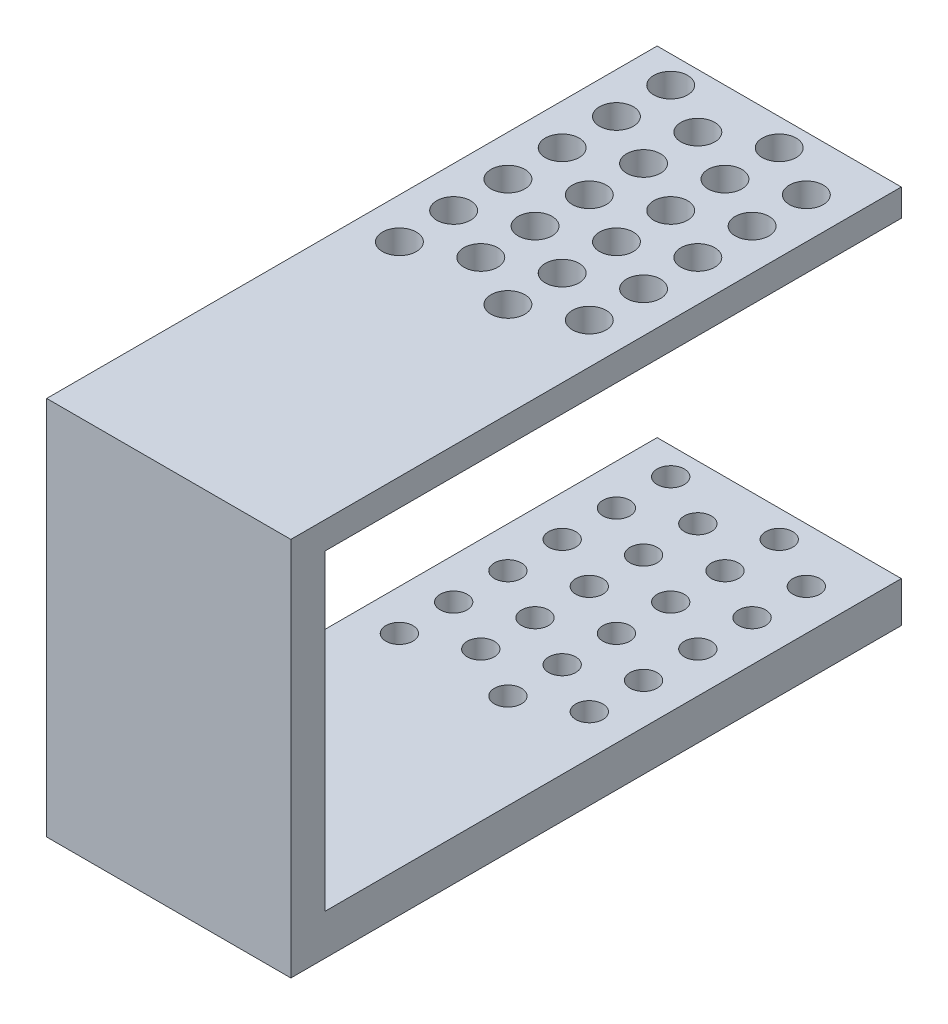
from build123d import *

# Parameters (mm, degrees)
SKETCH2_W           = 18
SKETCH2_H           = 24
SKETCH2_R           = 1.25
BOSS_EXTRUDE2_DEPTH = 2
SKETCH3_W           = 18
SKETCH3_H           = 2
BOSS_EXTRUDE3_DEPTH = 21
SKETCH4_W           = 18
SKETCH4_H           = 2.5
BOSS_EXTRUDE4_DEPTH = 26
SKETCH5_W           = 18
SKETCH5_H           = 3
BOSS_EXTRUDE5_DEPTH = 42.5
SKETCH15_R          = 1
CUT_EXTRUDE3_DEPTH  = 2


with BuildPart() as part:
    # Sketch2 → Boss-Extrude2 (new body)
    with BuildSketch(Plane(origin=(0, 0, 0), x_dir=(1, 0, 0), z_dir=(0, 1, 0))):
        with Locations((-11, 4)):
            Rectangle(SKETCH2_W, SKETCH2_H)
        with Locations(Location((-17, -6, 0), (0, 0, 270))):
            Circle(SKETCH2_R, mode=Mode.SUBTRACT)
        with Locations(Location((-17, -2, 0), (0, 0, 270))):
            Circle(SKETCH2_R, mode=Mode.SUBTRACT)
        with Locations(Location((-17, 2, 0), (0, 0, 270))):
            Circle(SKETCH2_R, mode=Mode.SUBTRACT)
        with Locations(Location((-17, 6, 0), (0, 0, 270))):
            Circle(SKETCH2_R, mode=Mode.SUBTRACT)
        with Locations(Location((-17, 10, 0), (0, 0, 270))):
            Circle(SKETCH2_R, mode=Mode.SUBTRACT)
        with Locations(Location((-17, 14, 0), (0, 0, 270))):
            Circle(SKETCH2_R, mode=Mode.SUBTRACT)
        with Locations(Location((-13, -4, 0), (0, 0, 270))):
            Circle(SKETCH2_R, mode=Mode.SUBTRACT)
        with Locations(Location((-13, 0, 0), (0, 0, 270))):
            Circle(SKETCH2_R, mode=Mode.SUBTRACT)
        with Locations(Location((-13, 4, 0), (0, 0, 270))):
            Circle(SKETCH2_R, mode=Mode.SUBTRACT)
        with Locations(Location((-13, 8, 0), (0, 0, 270))):
            Circle(SKETCH2_R, mode=Mode.SUBTRACT)
        with Locations(Location((-13, 12, 0), (0, 0, 270))):
            Circle(SKETCH2_R, mode=Mode.SUBTRACT)
        with Locations(Location((-9, -6, 0), (0, 0, 270))):
            Circle(SKETCH2_R, mode=Mode.SUBTRACT)
        with Locations(Location((-9, -2, 0), (0, 0, 270))):
            Circle(SKETCH2_R, mode=Mode.SUBTRACT)
        with Locations(Location((-9, 2, 0), (0, 0, 270))):
            Circle(SKETCH2_R, mode=Mode.SUBTRACT)
        with Locations(Location((-9, 6, 0), (0, 0, 270))):
            Circle(SKETCH2_R, mode=Mode.SUBTRACT)
        with Locations(Location((-9, 10, 0), (0, 0, 270))):
            Circle(SKETCH2_R, mode=Mode.SUBTRACT)
        with Locations(Location((-9, 14, 0), (0, 0, 270))):
            Circle(SKETCH2_R, mode=Mode.SUBTRACT)
        with Locations(Location((-5, -4, 0), (0, 0, 270))):
            Circle(SKETCH2_R, mode=Mode.SUBTRACT)
        with Locations(Location((-5, 0, 0), (0, 0, 270))):
            Circle(SKETCH2_R, mode=Mode.SUBTRACT)
        with Locations(Location((-5, 4, 0), (0, 0, 270))):
            Circle(SKETCH2_R, mode=Mode.SUBTRACT)
        with Locations(Location((-5, 8, 0), (0, 0, 270))):
            Circle(SKETCH2_R, mode=Mode.SUBTRACT)
        with Locations(Location((-5, 12, 0), (0, 0, 270))):
            Circle(SKETCH2_R, mode=Mode.SUBTRACT)
    extrude(amount=BOSS_EXTRUDE2_DEPTH)

    # Sketch3 → Boss-Extrude3 (add)
    with BuildSketch(Plane.XY.offset(8)):
        with Locations((-11, 1)):
            Rectangle(SKETCH3_W, SKETCH3_H)
    extrude(amount=BOSS_EXTRUDE3_DEPTH)

    # Sketch4 → Boss-Extrude4 (add)
    with BuildSketch(Plane(origin=(0, 0, 0), x_dir=(-1, 0, 0), z_dir=(0, -1, 0))):
        with Locations((11, -27.75)):
            Rectangle(SKETCH4_W, SKETCH4_H)
    extrude(amount=BOSS_EXTRUDE4_DEPTH)

    # Sketch5 → Boss-Extrude5 (add)
    with BuildSketch(Plane(origin=(0, 0, 26.5), x_dir=(-1, 0, 0), z_dir=(0, 0, -1))):
        with Locations((11, -24.5)):
            Rectangle(SKETCH5_W, SKETCH5_H)
    extrude(amount=BOSS_EXTRUDE5_DEPTH)

    # Sketch15 → Cut-Extrude3 (cut)
    with BuildSketch(Plane(origin=(0, -23, 0), x_dir=(1, 0, 0), z_dir=(0, 1, 0))):
        with Locations(Location((-17, -6, 0), (0, 0, 270))):
            Circle(SKETCH15_R)
        with Locations(Location((-17, -2, 0), (0, 0, 270))):
            Circle(SKETCH15_R)
        with Locations(Location((-17, 2, 0), (0, 0, 270))):
            Circle(SKETCH15_R)
        with Locations(Location((-17, 6, 0), (0, 0, 270))):
            Circle(SKETCH15_R)
        with Locations(Location((-17, 10, 0), (0, 0, 270))):
            Circle(SKETCH15_R)
        with Locations(Location((-17, 14, 0), (0, 0, 270))):
            Circle(SKETCH15_R)
        with Locations(Location((-13, -4, 0), (0, 0, 270))):
            Circle(SKETCH15_R)
        with Locations(Location((-13, 0, 0), (0, 0, 270))):
            Circle(SKETCH15_R)
        with Locations(Location((-13, 4, 0), (0, 0, 270))):
            Circle(SKETCH15_R)
        with Locations(Location((-13, 8, 0), (0, 0, 270))):
            Circle(SKETCH15_R)
        with Locations(Location((-13, 12, 0), (0, 0, 270))):
            Circle(SKETCH15_R)
        with Locations(Location((-9, -6, 0), (0, 0, 270))):
            Circle(SKETCH15_R)
        with Locations(Location((-9, -2, 0), (0, 0, 270))):
            Circle(SKETCH15_R)
        with Locations(Location((-9, 2, 0), (0, 0, 270))):
            Circle(SKETCH15_R)
        with Locations(Location((-9, 6, 0), (0, 0, 270))):
            Circle(SKETCH15_R)
        with Locations(Location((-9, 10, 0), (0, 0, 270))):
            Circle(SKETCH15_R)
        with Locations(Location((-9, 14, 0), (0, 0, 270))):
            Circle(SKETCH15_R)
        with Locations(Location((-5, -4, 0), (0, 0, 270))):
            Circle(SKETCH15_R)
        with Locations(Location((-5, 0, 0), (0, 0, 270))):
            Circle(SKETCH15_R)
        with Locations(Location((-5, 4, 0), (0, 0, 270))):
            Circle(SKETCH15_R)
        with Locations(Location((-5, 8, 0), (0, 0, 270))):
            Circle(SKETCH15_R)
        with Locations(Location((-5, 12, 0), (0, 0, 270))):
            Circle(SKETCH15_R)
    extrude(amount=-CUT_EXTRUDE3_DEPTH, mode=Mode.SUBTRACT)


solid = part.part
